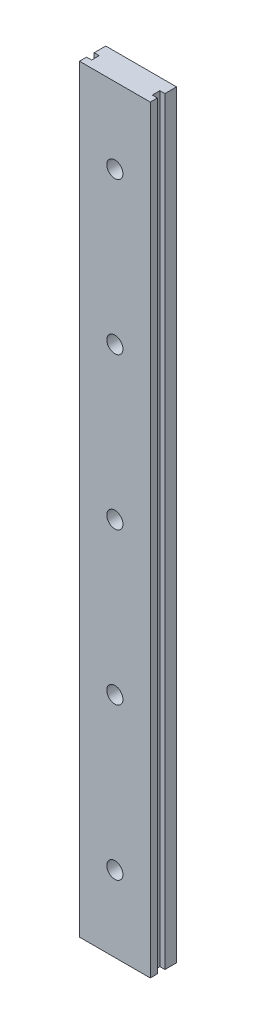
from build123d import *

# Parameters (mm, degrees)
EXTRUDE_1_DEPTH     = 150
SKETCH_2_R          = 1.6
CUT_EXTRUDE_1_DEPTH = 151.741633267


with BuildPart() as part:
    # 草图1 → 凸台-拉伸1 (new body)
    with BuildSketch(Plane(origin=(0, 0, 0), x_dir=(1, 0, 0), z_dir=(0, 1, 0))):
        Polygon((0, 0), (0, 1.4), (1, 1.4), (1, 2.9), (0, 2.9), (0, 5.2), (14, 5.2), (14, 2.9), (13, 2.9), (13, 1.4), (14, 1.4), (14, 0), align=None)
    extrude(amount=EXTRUDE_1_DEPTH)

    # 草图2 → 切除-拉伸1 (cut, through all)
    with BuildSketch(Plane(origin=(0, 0, -5.2), x_dir=(-1, 0, 0), z_dir=(0, 0, -1))):
        with Locations((-7, 15)):
            Circle(SKETCH_2_R)
        with Locations((-7, 45)):
            Circle(SKETCH_2_R)
        with Locations((-7, 75)):
            Circle(SKETCH_2_R)
        with Locations((-7, 105)):
            Circle(SKETCH_2_R)
        with Locations((-7, 135)):
            Circle(SKETCH_2_R)
    extrude(amount=-CUT_EXTRUDE_1_DEPTH, mode=Mode.SUBTRACT)


solid = part.part
